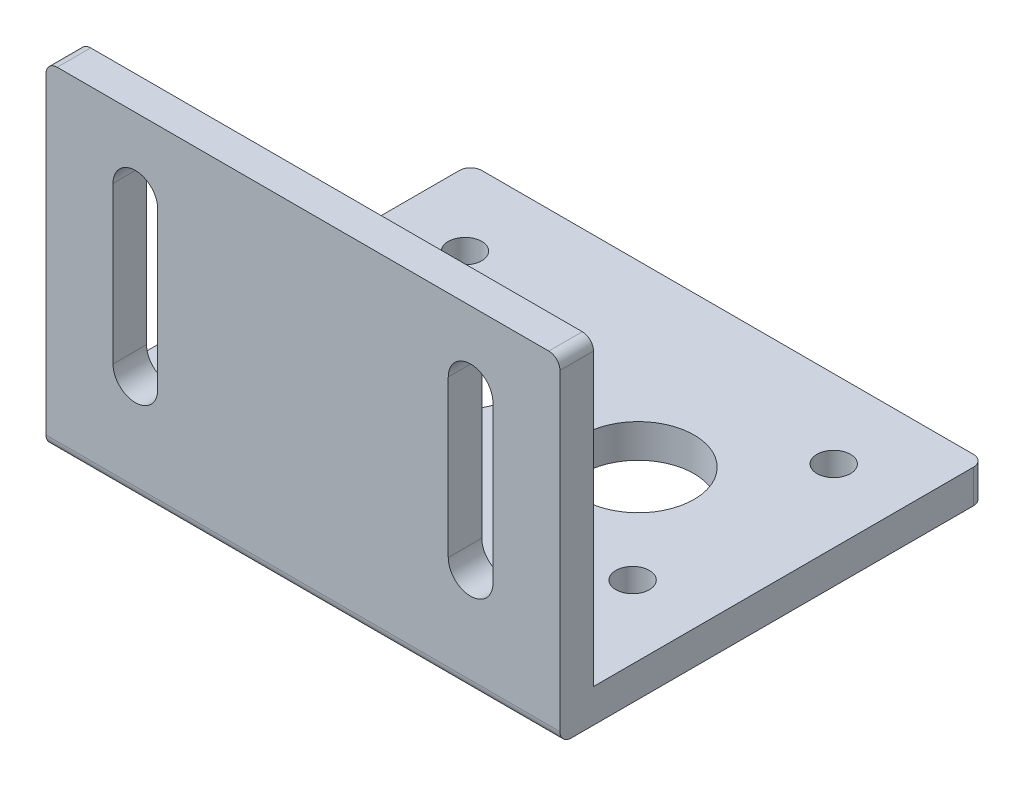
from build123d import *

# Parameters (mm, degrees)
SKETCH2_R           = 5
SKETCH2_R_2         = 1.5
BOSS_EXTRUDE1_DEPTH = 3
SKETCH3_W           = 46
SKETCH3_H           = 3
BOSS_EXTRUDE2_DEPTH = 27
CUT_EXTRUDE1_DEPTH  = 52.51698749
FILLET1_R           = 1
FILLET2_R           = 1


with BuildPart() as part:
    # Sketch2 → Boss-Extrude1 (new body)
    with BuildSketch(Plane(origin=(0, 0, 0), x_dir=(1, 0, 0), z_dir=(0, 1, 0))):
        with BuildLine():
            Line((-22, 19), (22, 19))
            ThreePointArc((22, 19), (22.707106781, 18.707106781), (23, 18))
            Line((23, 18), (23, -19))
            Line((23, -19), (-23, -19))
            Line((-23, -19), (-23, 18))
            ThreePointArc((-23, 18), (-22.707106781, 18.707106781), (-22, 19))
        make_face()
        with Locations(Location((8, 3, 0), (0, 0, 270))):
            Circle(SKETCH2_R, mode=Mode.SUBTRACT)
        with Locations(Location((-8, 3, 0), (0, 0, 90))):
            Circle(SKETCH2_R, mode=Mode.SUBTRACT)
        with Locations(Location((-16.5, 12, 0), (0, 0, 270))):
            Circle(SKETCH2_R_2, mode=Mode.SUBTRACT)
        with Locations(Location((-16.5, -6, 0), (0, 0, 90))):
            Circle(SKETCH2_R_2, mode=Mode.SUBTRACT)
        with Locations(Location((16.5, -6, 0), (0, 0, 270))):
            Circle(SKETCH2_R_2, mode=Mode.SUBTRACT)
        with Locations(Location((16.5, 12, 0), (0, 0, 90))):
            Circle(SKETCH2_R_2, mode=Mode.SUBTRACT)
    extrude(amount=BOSS_EXTRUDE1_DEPTH)

    # Sketch3 → Boss-Extrude2 (add)
    with BuildSketch(Plane(origin=(0, 3, 0), x_dir=(1, 0, 0), z_dir=(0, 1, 0))):
        with Locations((0, -17.5)):
            Rectangle(SKETCH3_W, SKETCH3_H)
    extrude(amount=BOSS_EXTRUDE2_DEPTH)

    # Sketch4 → Cut-Extrude1 (cut, through all)
    with BuildSketch(Plane(origin=(0, 0, 16), x_dir=(-1, 0, 0), z_dir=(0, 0, -1))):
        with BuildLine():
            Line((-17, 23.5), (-17, 9.5))
            ThreePointArc((-17, 9.5), (-15, 7.5), (-13, 9.5))
            Line((-13, 9.5), (-13, 23.5))
            ThreePointArc((-13, 23.5), (-15, 25.5), (-17, 23.5))
        make_face()
        with BuildLine():
            Line((13, 23.5), (13, 9.5))
            ThreePointArc((13, 9.5), (15, 7.5), (17, 9.5))
            Line((17, 9.5), (17, 23.5))
            ThreePointArc((17, 23.5), (15, 25.5), (13, 23.5))
        make_face()
    extrude(amount=-CUT_EXTRUDE1_DEPTH, mode=Mode.SUBTRACT)

    # Fillet1
    fillet1_edges = [part.edges().sort_by_distance(p)[0] for p in [
        (-23, 30, 17.5),
        (23, 30, 17.5),
    ]]
    fillet(fillet1_edges, radius=FILLET1_R)

    # Fillet2
    fillet2_edges = [part.edges().sort_by_distance(p)[0] for p in [
        (0, 0, 19),
    ]]
    fillet(fillet2_edges, radius=FILLET2_R)


solid = part.part
